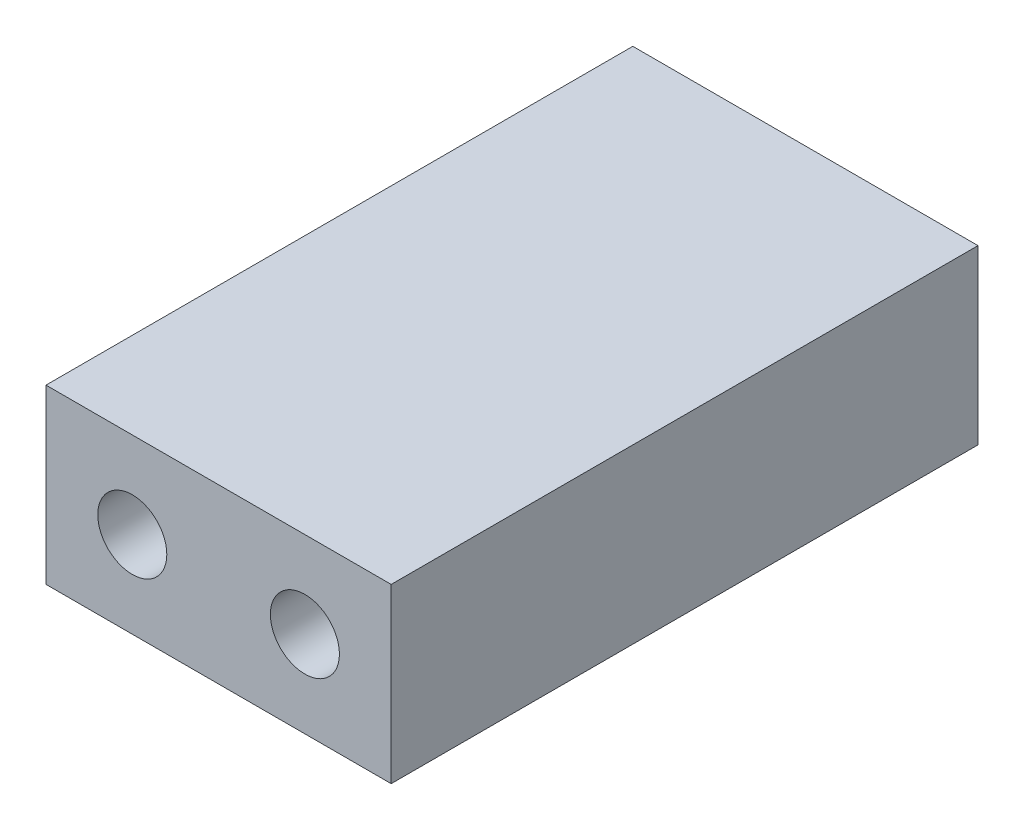
from build123d import *

# Parameters (mm, degrees)
SKETCH2_W           = 20
SKETCH2_H           = 10
BOSS_EXTRUDE1_DEPTH = 34
SKETCH3_R           = 2
CUT_EXTRUDE1_DEPTH  = 34


with BuildPart() as part:
    # Sketch2 → Boss-Extrude1 (new body)
    with BuildSketch(Plane.XY):
        Rectangle(SKETCH2_W, SKETCH2_H)
    extrude(amount=BOSS_EXTRUDE1_DEPTH)

    # Sketch3 → Cut-Extrude1 (cut)
    with BuildSketch(Plane.XY.offset(34)):
        with Locations((-5, 0)):
            Circle(SKETCH3_R)
        with Locations((5, 0)):
            Circle(SKETCH3_R)
    extrude(amount=-CUT_EXTRUDE1_DEPTH, mode=Mode.SUBTRACT)


solid = part.part
